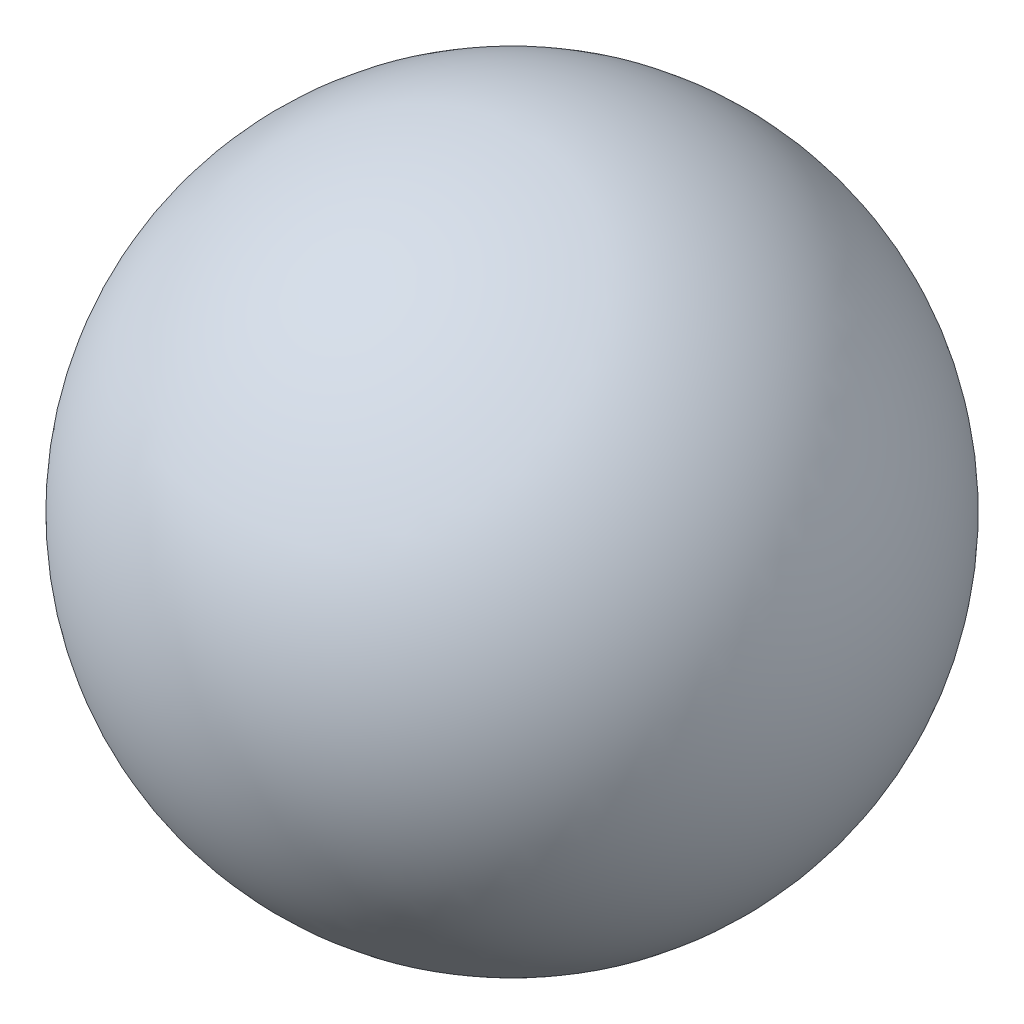
from build123d import *


with BuildPart() as part:
    # Sketch2 → Revolve1 (revolve)
    with BuildSketch(Plane.XY):
        with BuildLine():
            Line((0, 254), (0, -254))
            ThreePointArc((0, -254), (-254, 0), (0, 254))
        make_face()
    revolve(axis=Axis((0, 254, 0), (0, -1, 0)))


solid = part.part
